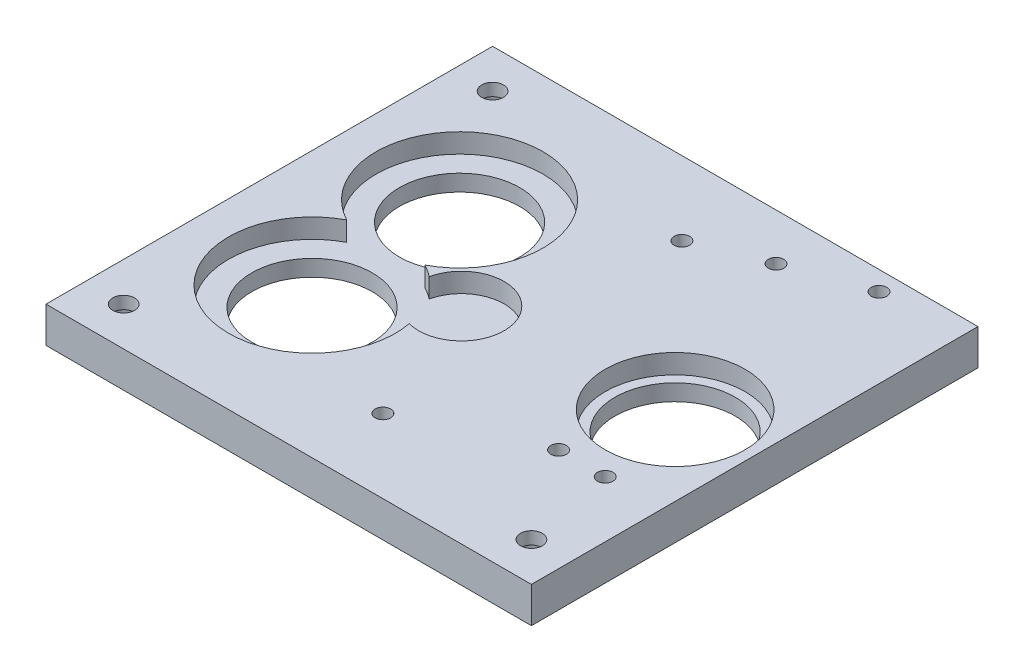
from build123d import *

# Parameters (mm, degrees)
SKETCH1_W                        = 125
SKETCH1_H                        = 115
TEST_BASE_POSTION_DEPTH          = 9.215
SKETCH8_R                        = 21.5
FINGER_GEARS_DEPTH               = 5
SKETCH9_R                        = 11
INTERMEDIATE_GEAR_DEPTH          = 5
SKETCH11_R                       = 18
XL320_FINGER_KNUCKLE_MOUNT_DEPTH = 5
SKETCH10_R                       = 15.5
CONNECT_FINGER_HOLES_DEPTH       = 86.424915715
THUMB_MOUNT_HOLES_R              = 2
THUMB_MOUNT_HOLES_M4_DEPTH       = 86.424915715
SKETCH16_R                       = 2
FINGERS_MOUNT_HOLES_M4_DEPTH     = 86.424915715
SKETCH17_R                       = 2.8
CONNECT_HOLES_M6_DEPTH           = 86.424915715
SKETCH18_R                       = 3.75
NUTS_M4_DEPTH                    = 4
SKETCH19_R                       = 5.25
CUT_EXTRUDE5_DEPTH               = 6


with BuildPart() as part:
    # Sketch1 → Test_Base_Postion (new body)
    with BuildSketch(Plane(origin=(0, 0, 0), x_dir=(1, 0, 0), z_dir=(0, 1, 0))):
        Rectangle(SKETCH1_W, SKETCH1_H)
    extrude(amount=TEST_BASE_POSTION_DEPTH)

    # Sketch8 → Finger_Gears (cut)
    with BuildSketch(Plane(origin=(0, 9.215, 0), x_dir=(1, 0, 0), z_dir=(0, 1, 0))):
        with Locations((-32.5, -19)):
            Circle(SKETCH8_R)
        with Locations((-32.5, 19)):
            Circle(SKETCH8_R)
    extrude(amount=-FINGER_GEARS_DEPTH, mode=Mode.SUBTRACT)

    # Sketch9 → Intermediate_Gear (cut)
    with BuildSketch(Plane(origin=(0, 9.215, 0), x_dir=(1, 0, 0), z_dir=(0, 1, 0))):
        with Locations((-8.576859648, -4.450657895)):
            Circle(SKETCH9_R)
    extrude(amount=-INTERMEDIATE_GEAR_DEPTH, mode=Mode.SUBTRACT)

    # Sketch11 → XL320_Finger_Knuckle_Mount (cut)
    with BuildSketch(Plane(origin=(0, 9.215, 0), x_dir=(1, 0, 0), z_dir=(0, 1, 0))):
        with Locations(Location((42, 0, 0), (0, 0, 270))):
            Circle(SKETCH11_R)
    extrude(amount=-XL320_FINGER_KNUCKLE_MOUNT_DEPTH, mode=Mode.SUBTRACT)

    # Sketch10 → Connect_Finger_Holes (cut, through all)
    with BuildSketch(Plane(origin=(0, 9.215, 0), x_dir=(1, 0, 0), z_dir=(0, 1, 0))):
        with Locations(Location((-32.5, 19, 0), (0, 0, 270))):
            Circle(SKETCH10_R)
        with Locations(Location((-32.5, -19, 0), (0, 0, 270))):
            Circle(SKETCH10_R)
        with Locations(Location((42, 0, 0), (0, 0, 270))):
            Circle(SKETCH10_R)
    extrude(amount=-CONNECT_FINGER_HOLES_DEPTH, mode=Mode.SUBTRACT)

    # Thumb_Mount_Holes → Thumb_Mount_Holes_(M4) (cut, through all)
    with BuildSketch(Plane(origin=(0, 9.215, 0), x_dir=(1, 0, 0), z_dir=(0, 1, 0))):
        with Locations(Location((22.5, 45.5, 0), (0, 0, 270))):
            Circle(THUMB_MOUNT_HOLES_R)
        with Locations(Location((42, 52.5, 0), (0, 0, 270))):
            Circle(THUMB_MOUNT_HOLES_R)
        with Locations(Location((48, -24, 0), (0, 0, 270))):
            Circle(THUMB_MOUNT_HOLES_R)
        with Locations(Location((36, -24, 0), (0, 0, 90))):
            Circle(THUMB_MOUNT_HOLES_R)
    extrude(amount=-THUMB_MOUNT_HOLES_M4_DEPTH, mode=Mode.SUBTRACT)

    # Sketch16 → Fingers_Mount_Holes_(M4) (cut, through all)
    with BuildSketch(Plane(origin=(0, 9.215, 0), x_dir=(1, 0, 0), z_dir=(0, 1, 0))):
        with Locations(Location((5.25, 38.5, 0), (0, 0, 270))):
            Circle(SKETCH16_R)
        with Locations(Location((5.25, -38.5, 0), (0, 0, 90))):
            Circle(SKETCH16_R)
    extrude(amount=-FINGERS_MOUNT_HOLES_M4_DEPTH, mode=Mode.SUBTRACT)

    # Sketch17 → Connect_Holes_(M6) (cut, through all)
    with BuildSketch(Plane(origin=(0, 9.215, 0), x_dir=(1, 0, 0), z_dir=(0, 1, 0))):
        with Locations(Location((-52.5, 47.5, 0), (0, 0, 270))):
            Circle(SKETCH17_R)
        with Locations(Location((-52.5, -47.5, 0), (0, 0, 90))):
            Circle(SKETCH17_R)
        with Locations(Location((52.5, -47.5, 0), (0, 0, 270))):
            Circle(SKETCH17_R)
    extrude(amount=-CONNECT_HOLES_M6_DEPTH, mode=Mode.SUBTRACT)

    # Sketch18 → Nuts_(M4) (cut)
    with BuildSketch(Plane.XZ):
        with Locations(Location((5.25, 38.5, 0), (0, 0, 270))):
            Circle(SKETCH18_R)
        with Locations(Location((5.25, -38.5, 0), (0, 0, 270))):
            Circle(SKETCH18_R)
        with Locations(Location((22.5, -45.5, 0), (0, 0, 270))):
            Circle(SKETCH18_R)
        with Locations(Location((42, -52.5, 0), (0, 0, 270))):
            Circle(SKETCH18_R)
        with Locations(Location((36, 24, 0), (0, 0, 270))):
            Circle(SKETCH18_R)
        with Locations(Location((48, 24, 0), (0, 0, 270))):
            Circle(SKETCH18_R)
    extrude(amount=-NUTS_M4_DEPTH, mode=Mode.SUBTRACT)

    # Sketch19 → Cut-Extrude5 (cut)
    with BuildSketch(Plane.XZ):
        with Locations(Location((-52.5, 47.5, 0), (0, 0, 270))):
            Circle(SKETCH19_R)
        with Locations(Location((52.5, 47.5, 0), (0, 0, 270))):
            Circle(SKETCH19_R)
        with Locations(Location((-52.5, -47.5, 0), (0, 0, 270))):
            Circle(SKETCH19_R)
    extrude(amount=-CUT_EXTRUDE5_DEPTH, mode=Mode.SUBTRACT)


solid = part.part
